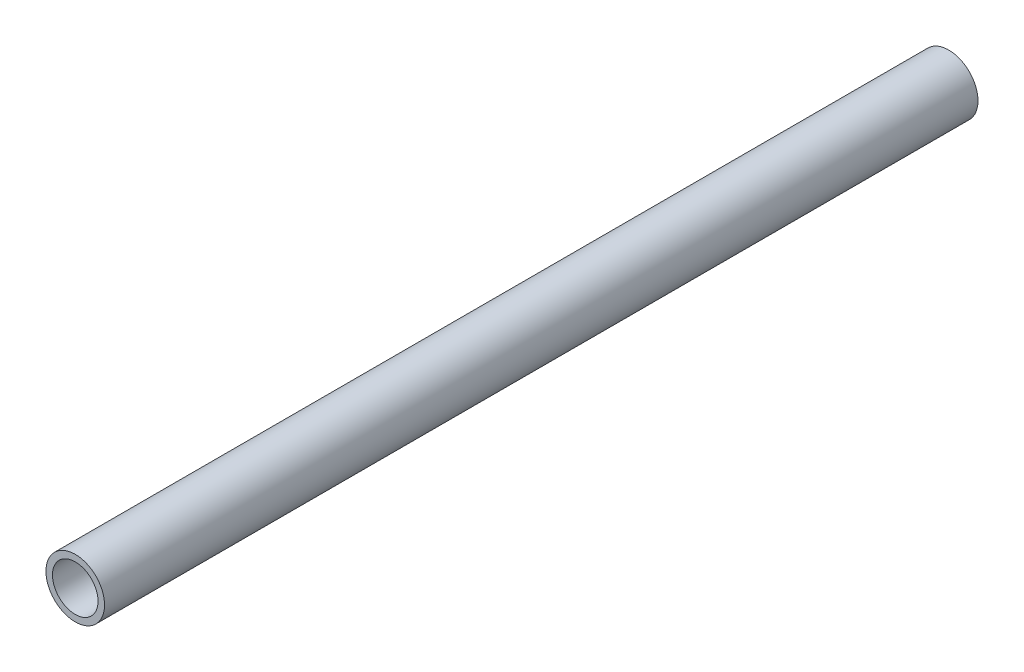
from build123d import *

# Parameters (mm, degrees)
SKETCH1_R           = 54
SKETCH1_R_2         = 42
BOSS_EXTRUDE1_DEPTH = 805


with BuildPart() as part:
    # Sketch1 → Boss-Extrude1 (new, symmetric)
    with BuildSketch(Plane.XY):
        Circle(SKETCH1_R)
        Circle(SKETCH1_R_2, mode=Mode.SUBTRACT)
    extrude(amount=BOSS_EXTRUDE1_DEPTH, both=True)


solid = part.part
